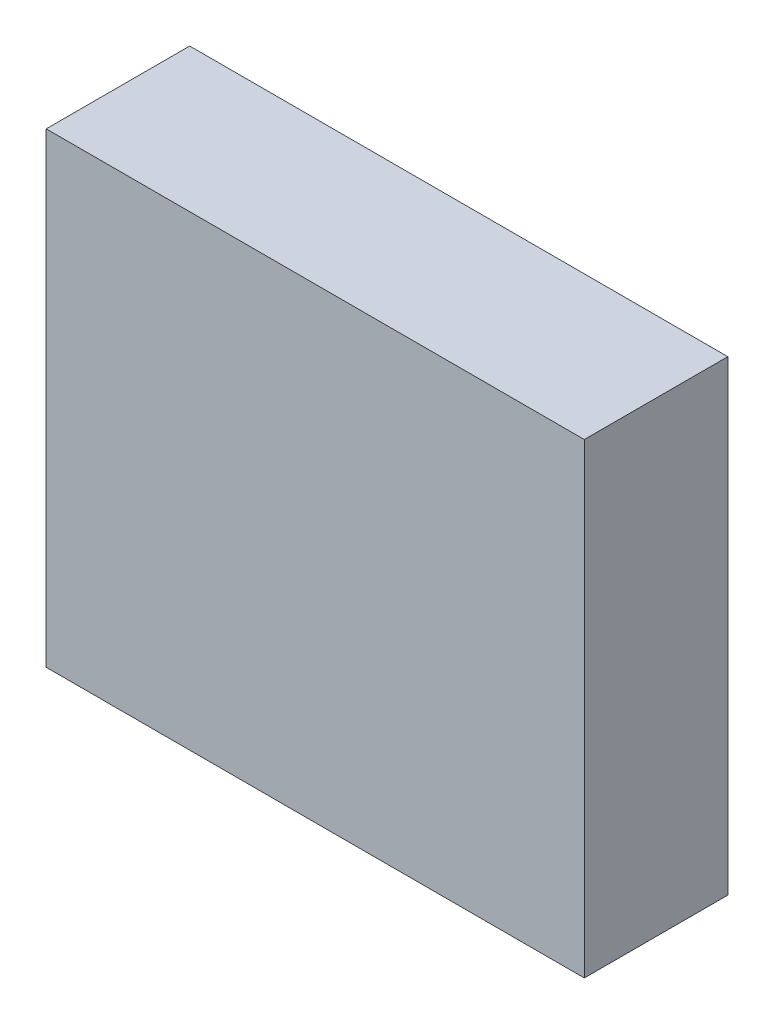
from build123d import *

# Parameters (mm, degrees)
ESQUISSE2_W        = 75
ESQUISSE2_H        = 65
BOSS_EXTRU_1_DEPTH = 20


with BuildPart() as part:
    # Esquisse2 → Boss.-Extru.1 (new body)
    with BuildSketch(Plane.XY):
        Rectangle(ESQUISSE2_W, ESQUISSE2_H)
    extrude(amount=BOSS_EXTRU_1_DEPTH)


solid = part.part
